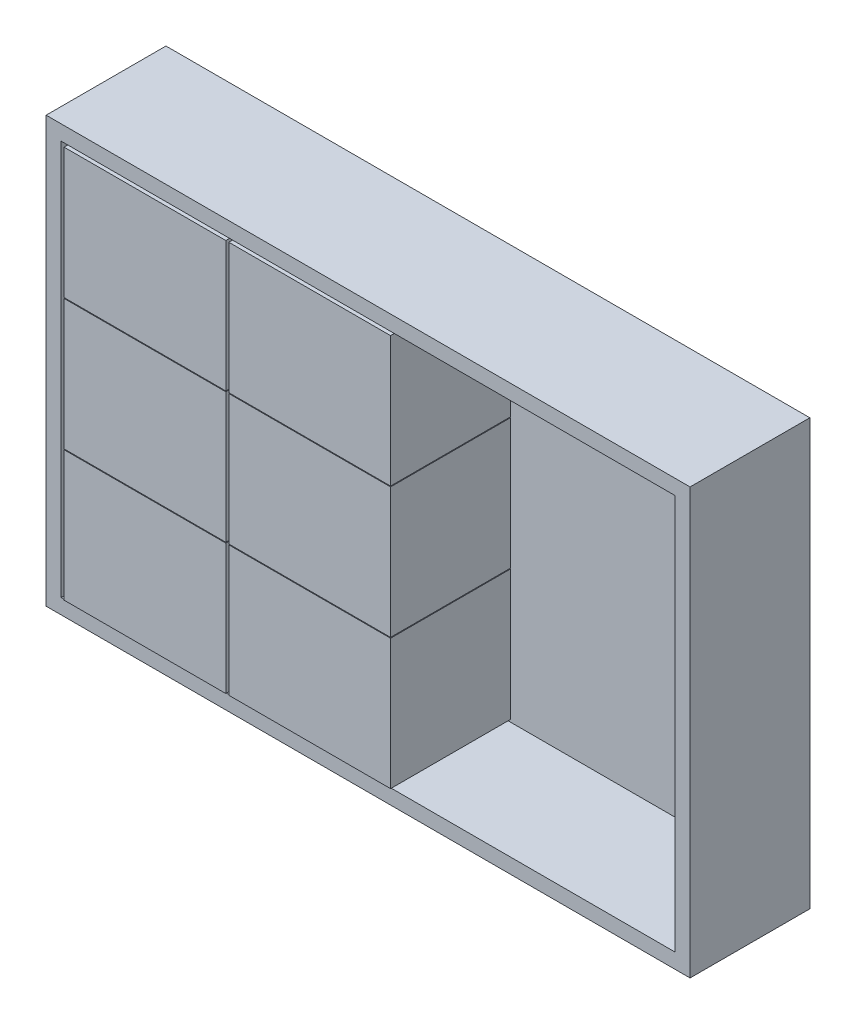
from build123d import *

# Parameters (mm, degrees)
ESQUISSE1_W                     = 205
ESQUISSE1_H                     = 132
BOSS_EXTRU_1_DEPTH              = 1
ESQUISSE1_2_W                   = 215
ESQUISSE1_2_H                   = 142
ESQUISSE1_2_W_2                 = 205
ESQUISSE1_2_H_2                 = 132
EXTRU_MINCE1_DEPTH              = 40
ESQUISSE2_W                     = 54
ESQUISSE2_H                     = 43.5
BOSS_EXTRU_2_DEPTH              = 40
R_P_TITION_LIN_AIRE1_COUNT      = 3
R_P_TITION_LIN_AIRE1_PITCH      = 43.75
R_P_TITION_LIN_AIRE1_COUNT_DIR2 = 2
R_P_TITION_LIN_AIRE1_PITCH_DIR2 = 55


with BuildPart() as part:
    # Esquisse1 → Boss.-Extru.1 (new body)
    with BuildSketch(Plane.XY):
        with Locations((102.5, 66)):
            Rectangle(ESQUISSE1_W, ESQUISSE1_H)
    extrude(amount=BOSS_EXTRU_1_DEPTH)

    # Esquisse1<2> → Extru.-Mince1 (add)
    with BuildSketch(Plane.XY):
        with Locations((102.5, 66)):
            Rectangle(ESQUISSE1_2_W, ESQUISSE1_2_H)
        with Locations((102.5, 66)):
            Rectangle(ESQUISSE1_2_W_2, ESQUISSE1_2_H_2, mode=Mode.SUBTRACT)
    extrude(amount=EXTRU_MINCE1_DEPTH)

    # Esquisse2 → Boss.-Extru.2 (add)
    with BuildSketch(Plane.XY.offset(1)):
        with Locations((29, 110)):
            Rectangle(ESQUISSE2_W, ESQUISSE2_H)
    boss_extru_2 = extrude(amount=BOSS_EXTRU_2_DEPTH)

    # Répétition linéaire1: Boss.-Extru.2 3 × 2
    with Locations(*[(j * R_P_TITION_LIN_AIRE1_PITCH_DIR2, -i * R_P_TITION_LIN_AIRE1_PITCH, 0) for i in range(R_P_TITION_LIN_AIRE1_COUNT) for j in range(R_P_TITION_LIN_AIRE1_COUNT_DIR2) if (i, j) != (0, 0)]):
        add(boss_extru_2)


solid = part.part
